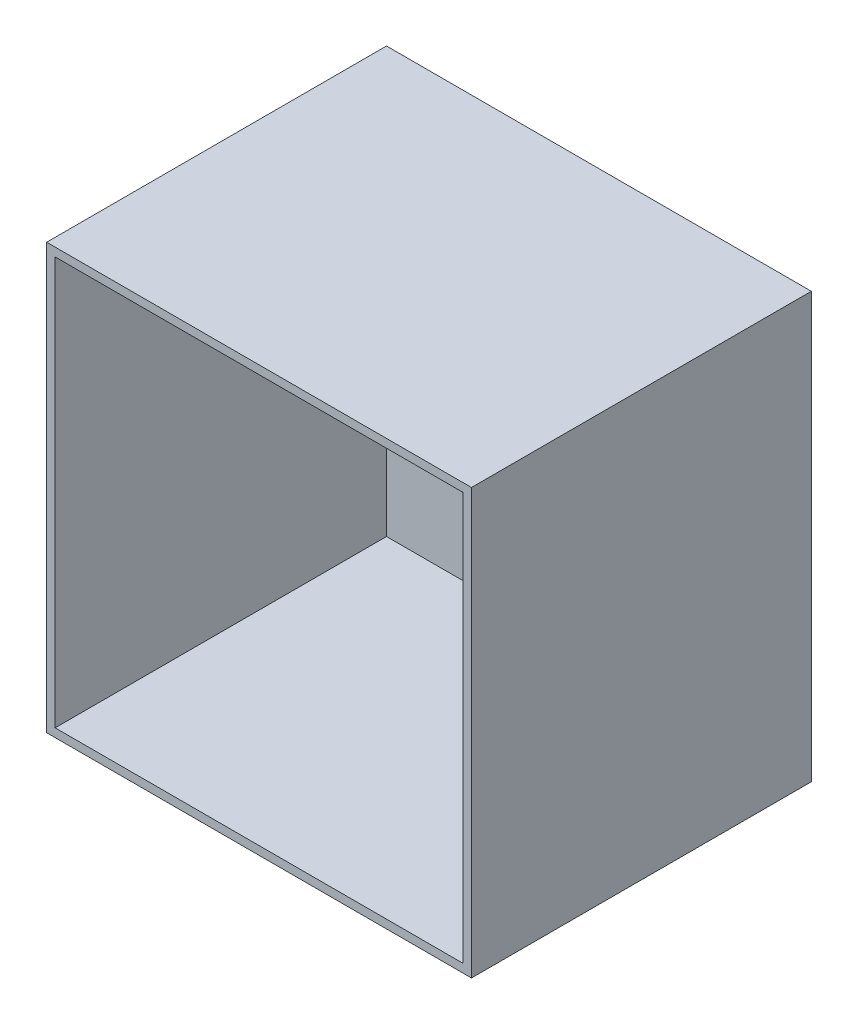
from build123d import *

# Parameters (mm, degrees)
SKETCH_1_W      = 150
SKETCH_1_H      = 150
EXTRUDE_1_DEPTH = 120
SHELL_1_T       = -3


with BuildPart() as part:
    # 草图1 → 凸台-拉伸1 (new body)
    with BuildSketch(Plane.XY):
        with Locations((75, -75)):
            Rectangle(SKETCH_1_W, SKETCH_1_H)
    extrude(amount=EXTRUDE_1_DEPTH)

    # 抽壳1
    shell_1_openings = [part.faces().sort_by_distance(p)[0] for p in [
        (75, -75, 120),
    ]]
    offset(amount=SHELL_1_T, openings=shell_1_openings, kind=Kind.INTERSECTION)


solid = part.part
